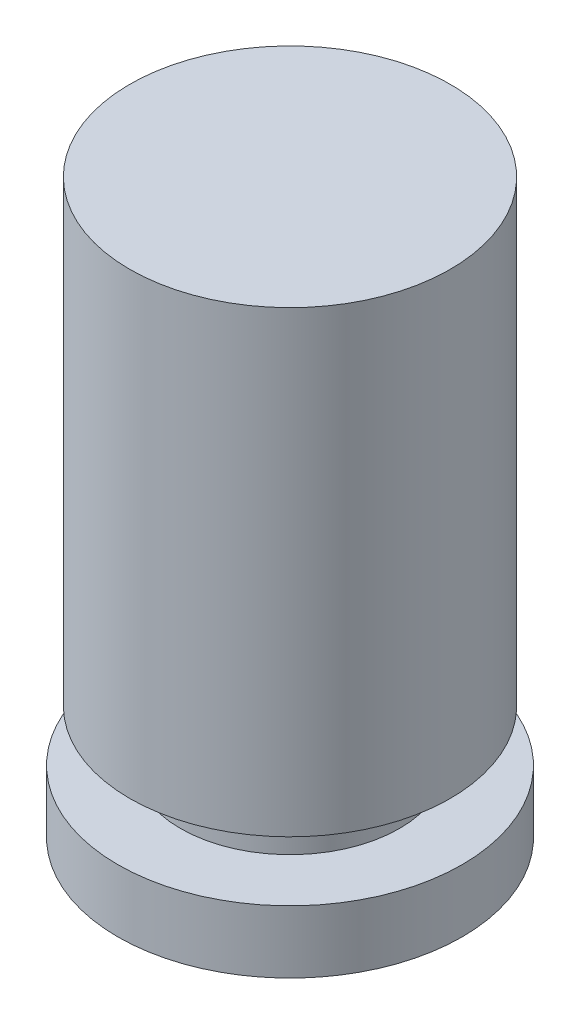
from build123d import *

# Parameters (mm, degrees)
SKETCH1_R           = 34.925
BOSS_EXTRUDE1_DEPTH = 12.7
SKETCH2_R           = 22.225
BOSS_EXTRUDE2_DEPTH = 10.414
SKETCH3_R           = 32.512
BOSS_EXTRUDE3_DEPTH = 92.964


with BuildPart() as part:
    # Sketch1 → Boss-Extrude1 (new body)
    with BuildSketch(Plane(origin=(0, 0, 0), x_dir=(1, 0, 0), z_dir=(0, 1, 0))):
        with Locations(Location((0, 0, 0), (0, 0, 270))):
            Circle(SKETCH1_R)
    extrude(amount=BOSS_EXTRUDE1_DEPTH)

    # Sketch2 → Boss-Extrude2 (add)
    with BuildSketch(Plane(origin=(0, 12.7, 0), x_dir=(1, 0, 0), z_dir=(0, 1, 0))):
        with Locations(Location((0, 0, 0), (0, 0, 270))):
            Circle(SKETCH2_R)
    extrude(amount=BOSS_EXTRUDE2_DEPTH)

    # Sketch3 → Boss-Extrude3 (add)
    with BuildSketch(Plane(origin=(0, 23.114, 0), x_dir=(1, 0, 0), z_dir=(0, 1, 0))):
        with Locations(Location((0, 0, 0), (0, 0, 270))):
            Circle(SKETCH3_R)
    extrude(amount=BOSS_EXTRUDE3_DEPTH)


solid = part.part
